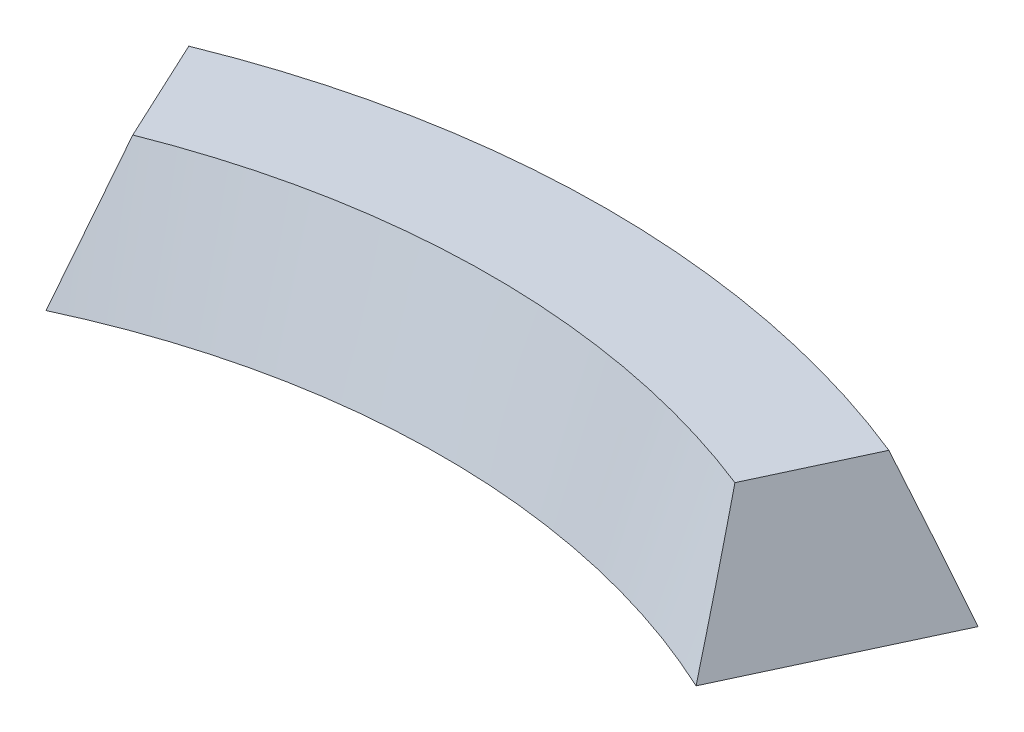
from build123d import *

# Parameters (mm, degrees)
BOSS_EXTRUDE1_DEPTH = 5
BOSS_EXTRUDE1_DRAFT = 20


with BuildPart() as part:
    # Sketch1 → Boss-Extrude1 (with draft: the straight prism first)
    with BuildSketch(Plane(origin=(0, 0, 0), x_dir=(1, 0, 0), z_dir=(0, 1, 0))):
        with BuildLine():
            ThreePointArc((-11.665966043, 26.317103556), (0.589963547, 29.034177732), (12.845893138, 26.317103556))
            Line((12.845893138, 26.317103556), (16.226839231, 33.567565853))
            ThreePointArc((16.226839231, 33.567565853), (0.589963547, 37.034177732), (-15.046912137, 33.567565853))
            Line((-15.046912137, 33.567565853), (-11.665966043, 26.317103556))
        make_face()
    extrude(amount=BOSS_EXTRUDE1_DEPTH)
    # Boss-Extrude1: the draft: its side faces are tilted about the plane it starts from
    boss_extrude1_sides = [part.faces().sort_by_distance(p)[0] for p in [
        (-13.35643909, 2.5, -29.942334705),
        (0.589963547, 2.5, -29.034177732),
        (14.536366185, 2.5, -29.942334705),
        (0.589963547, 2.5, -37.034177732),
    ]]
    draft(boss_extrude1_sides, Plane(origin=(0, 0, 0), x_dir=(1, 0, 0), z_dir=(0, 1, 0)), BOSS_EXTRUDE1_DRAFT)


solid = part.part
